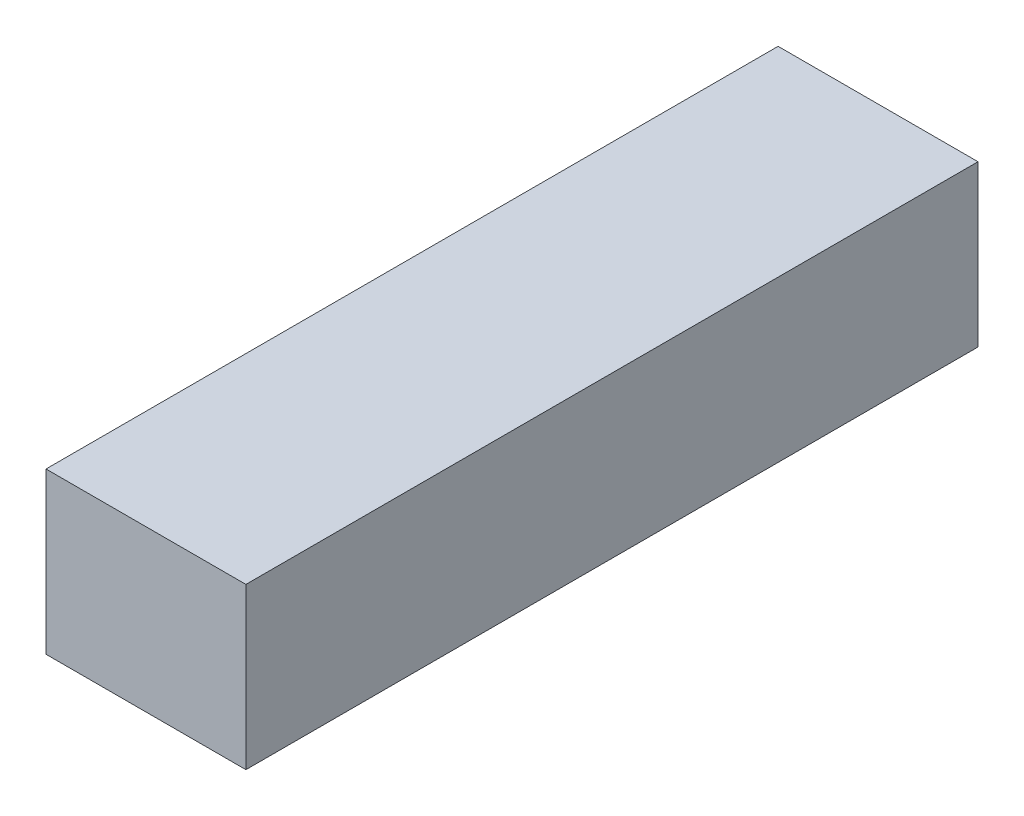
from build123d import *

# Parameters (mm, degrees)
SKETCH1_W           = 12.457273578
SKETCH1_H           = 45.62055594
BOSS_EXTRUDE1_DEPTH = 10


with BuildPart() as part:
    # Sketch1 → Boss-Extrude1 (new body)
    with BuildSketch(Plane(origin=(0, 0, 0), x_dir=(1, 0, 0), z_dir=(0, 1, 0))):
        Rectangle(SKETCH1_W, SKETCH1_H)
    extrude(amount=BOSS_EXTRUDE1_DEPTH)


solid = part.part
